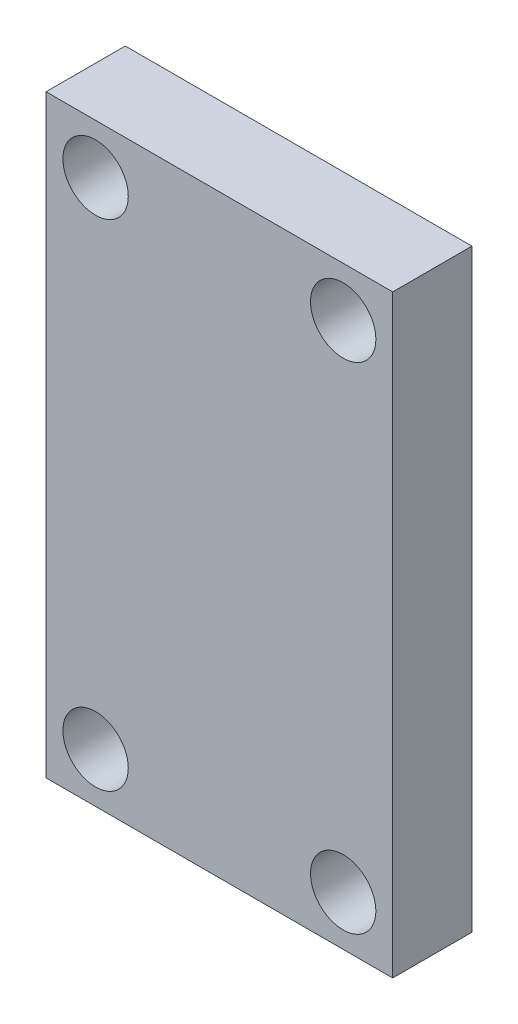
from build123d import *

# Parameters (mm, degrees)
SKETCH1_W           = 35
SKETCH1_H           = 60
BOSS_EXTRUDE1_DEPTH = 4


with BuildPart() as part:
    # Sketch1 → Boss-Extrude1 (new, symmetric)
    with BuildSketch(Plane.XY):
        Rectangle(SKETCH1_W, SKETCH1_H)
    extrude(amount=BOSS_EXTRUDE1_DEPTH, both=True)

    # Sketch3 → M6 Clearance Hole1 (revolve, cut)
    with BuildSketch(Plane(origin=(-12.5, 25, 4), x_dir=(0, -1, 0), z_dir=(1, 0, 0))):
        Polygon((0, 0), (0, 9.982840043), (3.3, 8), (3.3, 0), align=None)
    m6_clearance_hole1 = revolve(axis=Axis((-12.5, 25, 10.35), (0, 0, -1)), mode=Mode.SUBTRACT)

    # Mirror1: M6 Clearance Hole1 across plane
    add(m6_clearance_hole1.mirror(Plane(origin=(0, 0, 0), x_dir=(0, 0, 1), z_dir=(1, 0, 0))), mode=Mode.SUBTRACT)

    # Mirror2: M6 Clearance Hole1 across plane
    add(m6_clearance_hole1.mirror(Plane.ZX), mode=Mode.SUBTRACT)

    # Mirror2 copy 1 sketch → Mirror2 copy 1 (revolve, cut)
    with BuildSketch(Plane(origin=(12.5, -25, 4), x_dir=(0, 1, 0), z_dir=(-1, 0, 0))):
        Polygon((0, 0), (0, 9.982840043), (3.3, 8), (3.3, 0), align=None)
    revolve(axis=Axis((12.5, -25, 10.35), (0, 0, -1)), mode=Mode.SUBTRACT)


solid = part.part
